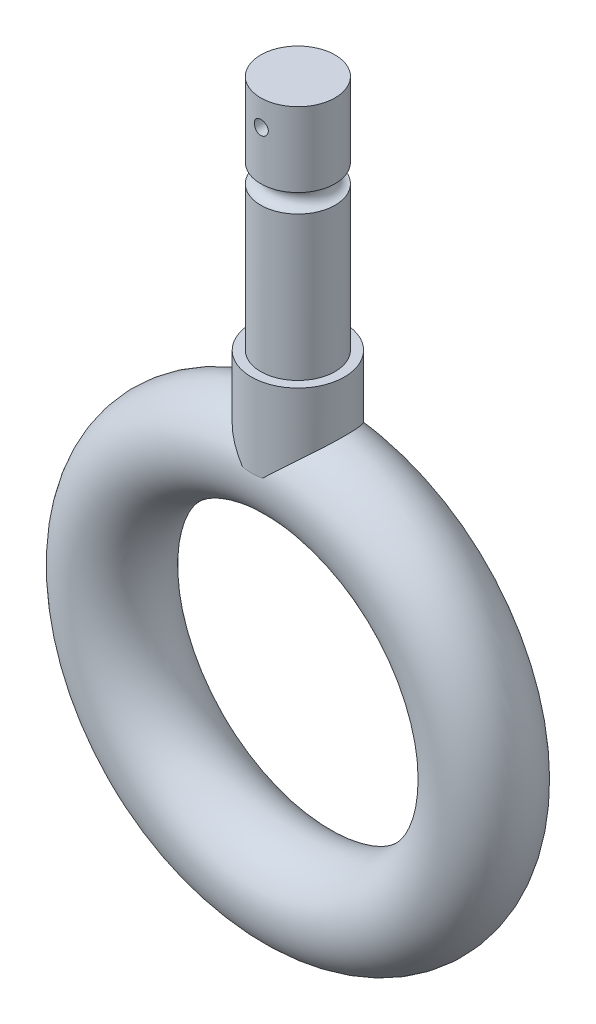
from build123d import *

# Parameters (mm, degrees)
IZIM1_R               = 10
IZIM3_R               = 1.5
KES_EKSTR_ZYON1_DEPTH = 15
IZIM4_R               = 2


with BuildPart() as part:
    # Çizim1 → Döndür1 (revolve)
    with BuildSketch(Plane(origin=(0, 0, 0), x_dir=(0, 0, -1), z_dir=(1, 0, 0)), mode=Mode.PRIVATE) as d_nd_r1_sk:
        with Locations((0, 40)):
            Circle(IZIM1_R)
    revolve(d_nd_r1_sk.sketch.rotate(Axis((0, 0, 15.200888332), (0, 0, -1)), 90), axis=Axis((0, 0, 15.200888332), (0, 0, -1)))

    # Çizim2 → Döndür2 (revolve)
    with BuildSketch(Plane.XY):
        Polygon((0, 42.101423495), (0, 111), (8, 111), (8, 60), (10, 60), (10, 42.101423495), align=None)
    revolve(axis=Axis((0, 42.101423495, 0), (0, 1, 0)))

    # Çizim3 → Kes-Ekstrüzyon1 (cut, symmetric)
    with BuildSketch(Plane.XY):
        with Locations((0, 105.5)):
            Circle(IZIM3_R)
    extrude(amount=KES_EKSTR_ZYON1_DEPTH, both=True, mode=Mode.SUBTRACT)

    # Çizim4 → Kes-Döndür1 (revolve, cut)
    with BuildSketch(Plane.XY, mode=Mode.PRIVATE) as kes_d_nd_r1_sk:
        with Locations((-8, 93)):
            Circle(IZIM4_R)
    revolve(kes_d_nd_r1_sk.sketch.rotate(Axis((0, 111, 0), (0, -1, 0)), 180), axis=Axis((0, 111, 0), (0, -1, 0)), mode=Mode.SUBTRACT)


solid = part.part
